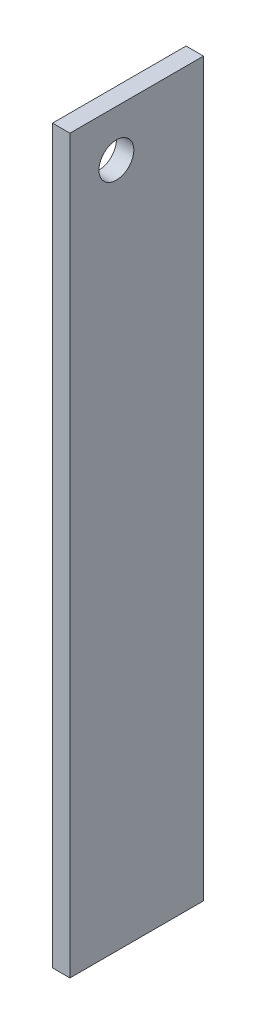
from build123d import *

# Parameters (mm, degrees)
SKETCH1_W               = 152.4
SKETCH1_H               = 1168.4
BOSS_EXTRUDE1_DEPTH     = 6400.8
CUT_EXTRUDE3_DEPTH      = 6430.211152233
CUT_EXTRUDE3_DEPTH_BACK = 6430.211152233
SKETCH4_R               = 152.4


with BuildPart() as part:
    # Sketch1 → Boss-Extrude1 (new body)
    with BuildSketch(Plane(origin=(0, 0, 0), x_dir=(1, 0, 0), z_dir=(0, 1, 0))):
        Rectangle(SKETCH1_W, SKETCH1_H)
    extrude(amount=BOSS_EXTRUDE1_DEPTH)

    # Sketch4 → Cut-Extrude3 (cut, two sides: drawn at the far end of the back side and taken through both)
    with BuildSketch(Plane.ZY.offset(76.2).offset(-CUT_EXTRUDE3_DEPTH_BACK)):
        with Locations((177.8, 5994.4)):
            Circle(SKETCH4_R)
    extrude(amount=CUT_EXTRUDE3_DEPTH + CUT_EXTRUDE3_DEPTH_BACK, mode=Mode.SUBTRACT)


solid = part.part
